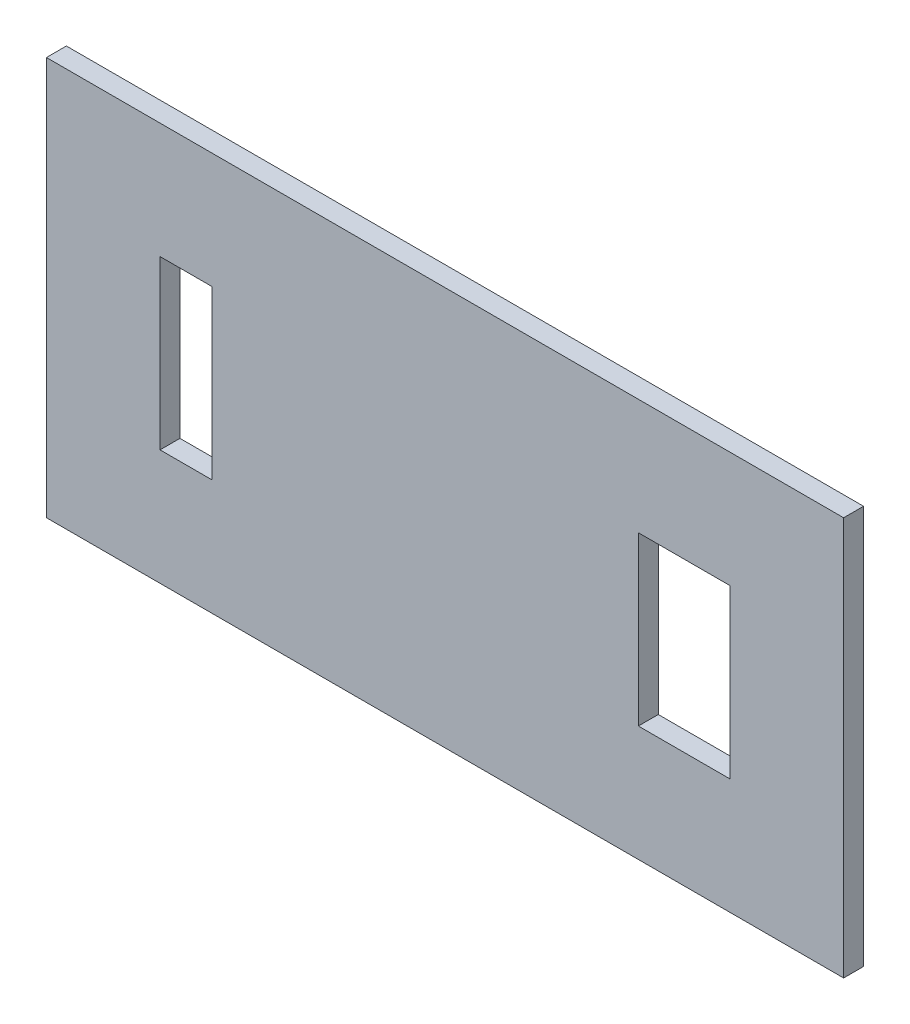
from build123d import *

# Parameters (mm, degrees)
SKETCH1_W           = 50.8
SKETCH1_H           = 25.4
SKETCH1_W_2         = 5.842
SKETCH1_H_2         = 10.668
SKETCH1_W_3         = 3.302
BOSS_EXTRUDE1_DEPTH = 1.27


with BuildPart() as part:
    # Sketch1 → Boss-Extrude1 (new body)
    with BuildSketch(Plane.XY):
        Rectangle(SKETCH1_W, SKETCH1_H)
        with Locations((15.24, 0)):
            Rectangle(SKETCH1_W_2, SKETCH1_H_2, mode=Mode.SUBTRACT)
        with Locations((-16.51, 0)):
            Rectangle(SKETCH1_W_3, SKETCH1_H_2, mode=Mode.SUBTRACT)
    extrude(amount=BOSS_EXTRUDE1_DEPTH)


solid = part.part
